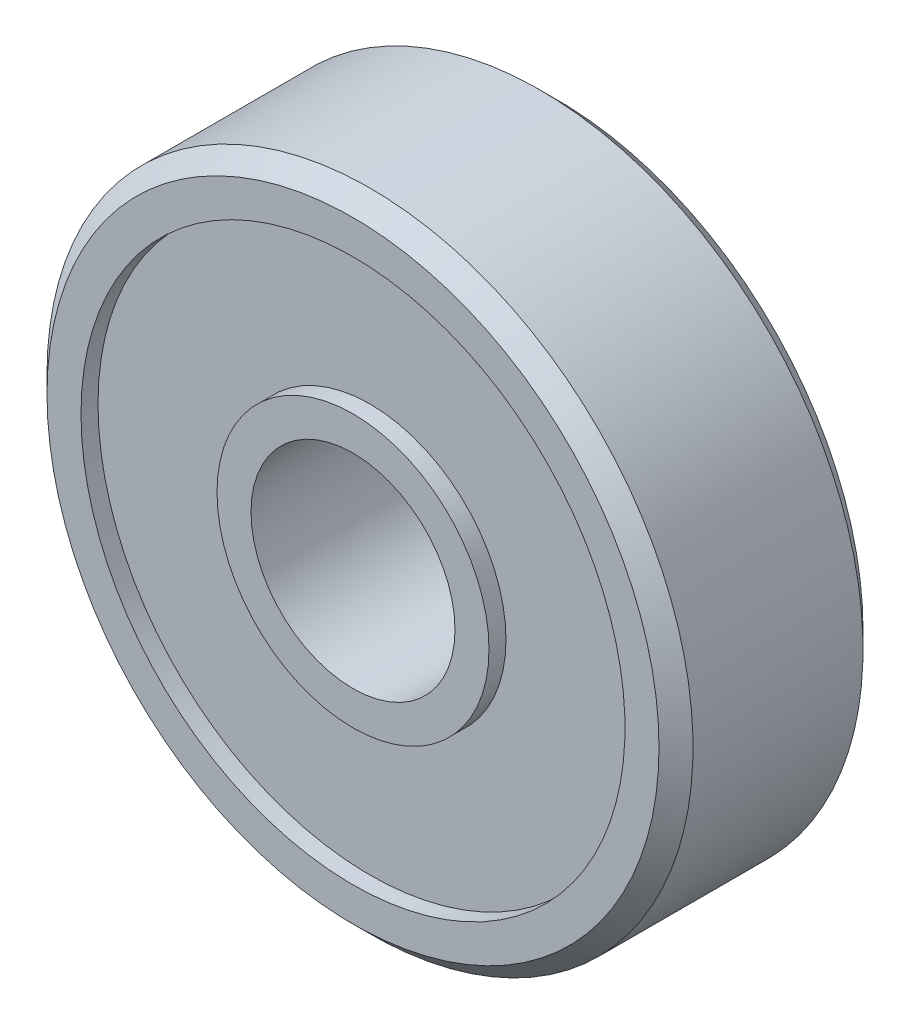
from build123d import *


with BuildPart() as part:
    # Sketch1 → Revolve1 (revolve)
    with BuildSketch(Plane.XZ, mode=Mode.PRIVATE) as revolve1_sk:
        Polygon((9.5, 1), (9, 1.5), (8, 1.5), (8, 1), (4, 1), (4, 1.5), (3, 1.5), (3, -4.5), (4, -4.5), (4, -4), (8, -4), (8, -4.5), (9, -4.5), (9.5, -4), align=None)
    revolve(revolve1_sk.sketch.rotate(Axis((0, 0, 0.5), (0, 0, -1)), 180), axis=Axis((0, 0, 0.5), (0, 0, -1)))


solid = part.part
